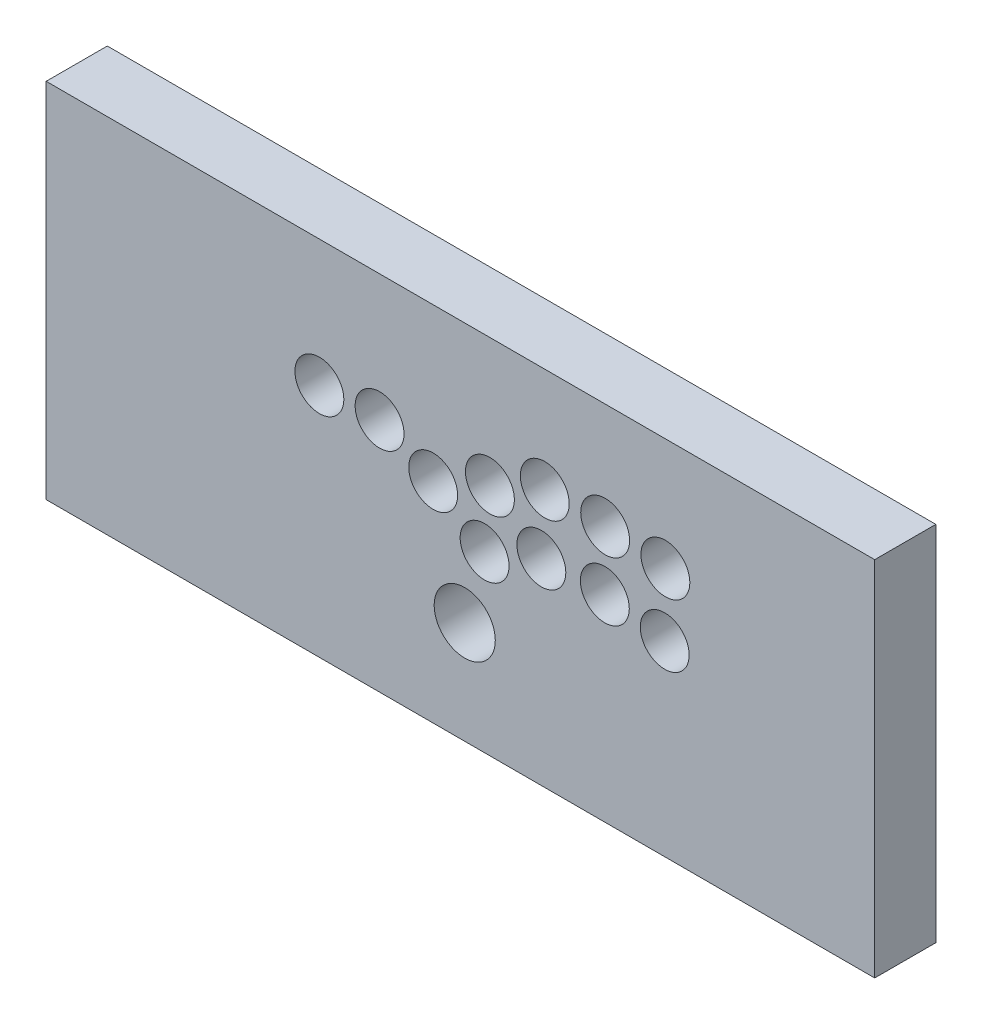
from build123d import *

# Parameters (mm, degrees)
ESQUISSE2_W        = 406.6
ESQUISSE2_H        = 177.8
ESQUISSE2_R        = 12
ESQUISSE2_R_2      = 15
BOSS_EXTRU_3_DEPTH = 30
ESQUISSE4_W        = 406.6
ESQUISSE4_H        = 177.8
BOSS_EXTRU_4_DEPTH = 4


with BuildPart() as part:
    # Esquisse2 → Boss.-Extru.3 (new body)
    with BuildSketch(Plane.XY):
        with Locations((203.3, 88.9)):
            Rectangle(ESQUISSE2_W, ESQUISSE2_H)
        with Locations((134.07925081, 115.620543461)):
            Circle(ESQUISSE2_R, mode=Mode.SUBTRACT)
        with Locations((163.619308258, 115.709309955)):
            Circle(ESQUISSE2_R, mode=Mode.SUBTRACT)
        with Locations((189.931391461, 102.812951429)):
            Circle(ESQUISSE2_R, mode=Mode.SUBTRACT)
        with Locations((215.148770887, 85.431045161)):
            Circle(ESQUISSE2_R, mode=Mode.SUBTRACT)
        with Locations((205.406615555, 50.360364433)):
            Circle(ESQUISSE2_R_2, mode=Mode.SUBTRACT)
        with Locations((217.770290506, 114.829364891)):
            Circle(ESQUISSE2_R, mode=Mode.SUBTRACT)
        with Locations((244.688210229, 126.551247272)):
            Circle(ESQUISSE2_R, mode=Mode.SUBTRACT)
        with Locations((274.33036562, 125.743518948)):
            Circle(ESQUISSE2_R, mode=Mode.SUBTRACT)
        with Locations((303.876863168, 122.656060434)):
            Circle(ESQUISSE2_R, mode=Mode.SUBTRACT)
        with Locations((303.54762398, 91.701693193)):
            Circle(ESQUISSE2_R, mode=Mode.SUBTRACT)
        with Locations((274.160623302, 96.722519891)):
            Circle(ESQUISSE2_R, mode=Mode.SUBTRACT)
        with Locations((243.010025324, 96.447343803)):
            Circle(ESQUISSE2_R, mode=Mode.SUBTRACT)
    extrude(amount=BOSS_EXTRU_3_DEPTH)

    # Esquisse4 → Boss.-Extru.4 (add)
    with BuildSketch(Plane(origin=(0, 0, 0), x_dir=(-1, 0, 0), z_dir=(0, 0, -1))):
        with Locations((-203.3, 88.9)):
            Rectangle(ESQUISSE4_W, ESQUISSE4_H)
    extrude(amount=-BOSS_EXTRU_4_DEPTH)


solid = part.part
